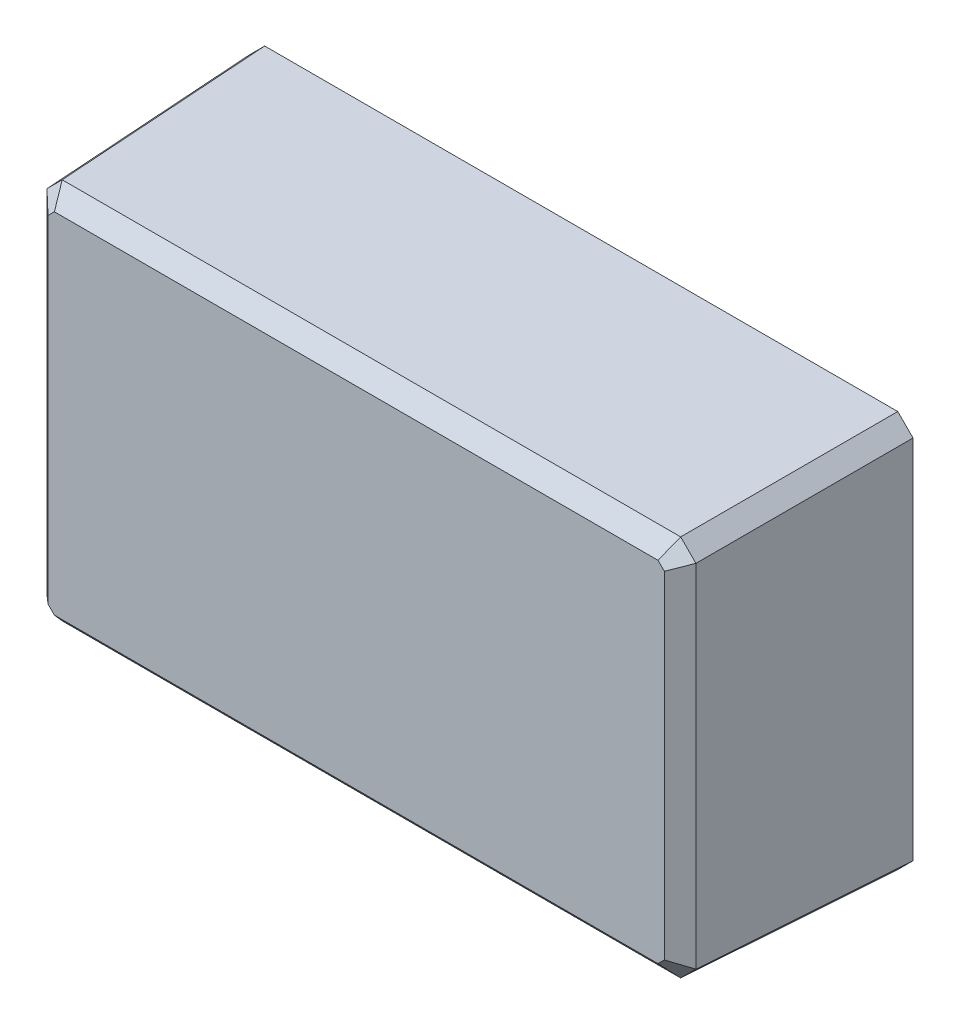
from build123d import *
from OCP.BRepFilletAPI import BRepFilletAPI_MakeChamfer

# Parameters (mm, degrees)
SKETCH1_W           = 87
SKETCH1_H           = 52
BOSS_EXTRUDE1_DEPTH = 29.5
BOSS_EXTRUDE1_TAPER = 2
CHAMFER1_SIZE       = 2
CHAMFER1_SIZE2      = 2.002440407
CHAMFER2_SIZE       = 2
CHAMFER2_SIZE2      = 2.073631911
CHAMFER2_SIZE2_2    = 2.106466142
SKETCH2_R           = 0.5
SKETCH2_R_2         = 1
BOSS_EXTRUDE2_DEPTH = 3.5


with BuildPart() as part:
    # Sketch1 → Boss-Extrude1 (new body)
    with BuildSketch(Plane.XY):
        Rectangle(SKETCH1_W, SKETCH1_H)
    extrude(amount=BOSS_EXTRUDE1_DEPTH, taper=BOSS_EXTRUDE1_TAPER)

    # Chamfer1: one chamfer whose edges measure the first distance from different faces: ONE call of the kernel's chamfer builder (chamfer() names one face for all edges)
    chamfer1_edges_1 = [part.edges().sort_by_distance(p)[0] for p in [
        (42.98491865, -25.48491865, 14.75),
    ]]
    chamfer1_side_1 = [part.faces().sort_by_distance(p)[0] for p in [
        (0, -25.486976029, 14.691084376),
    ]]
    chamfer1_edges_2 = [part.edges().sort_by_distance(p)[0] for p in [
        (-42.984918188, -25.484918188, 14.750013228),
    ]]
    chamfer1_side_2 = [part.faces().sort_by_distance(p)[0] for p in [
        (-42.988388791, 0, 14.650628158),
    ]]
    chamfer1_edges_3 = [part.edges().sort_by_distance(p)[0] for p in [
        (-42.98491865, 25.48491865, 14.75),
    ]]
    chamfer1_side_3 = [part.faces().sort_by_distance(p)[0] for p in [
        (0, 25.486976029, 14.691084376),
    ]]
    chamfer1_edges_4 = [part.edges().sort_by_distance(p)[0] for p in [
        (42.98491865, 25.48491865, 14.75),
    ]]
    chamfer1_side_4 = [part.faces().sort_by_distance(p)[0] for p in [
        (42.988388791, 0, 14.650628158),
    ]]
    chamfer1 = BRepFilletAPI_MakeChamfer(part.part.solid().wrapped)
    for e in chamfer1_edges_1:
        chamfer1.Add(CHAMFER1_SIZE, CHAMFER1_SIZE2, e.wrapped, chamfer1_side_1[0].wrapped)  # the first distance lies on this face
    for e in chamfer1_edges_2:
        chamfer1.Add(CHAMFER1_SIZE, CHAMFER1_SIZE2, e.wrapped, chamfer1_side_2[0].wrapped)  # the first distance lies on this face
    for e in chamfer1_edges_3:
        chamfer1.Add(CHAMFER1_SIZE, CHAMFER1_SIZE2, e.wrapped, chamfer1_side_3[0].wrapped)  # the first distance lies on this face
    for e in chamfer1_edges_4:
        chamfer1.Add(CHAMFER1_SIZE, CHAMFER1_SIZE2, e.wrapped, chamfer1_side_4[0].wrapped)  # the first distance lies on this face
    add(Compound.cast(chamfer1.Shape()), mode=Mode.REPLACE)

    # Chamfer2: one chamfer whose edges measure the first distance from different faces: ONE call of the kernel's chamfer builder (chamfer() names one face for all edges)
    chamfer2_edges_1 = [part.edges().sort_by_distance(p)[0] for p in [
        (42.4698373, 0.001220947, 29.5),
    ]]
    chamfer2_side_1 = [part.faces().sort_by_distance(p)[0] for p in [
        (42.988684703, 0.001220947, 14.642154351),
    ]]
    chamfer2_edges_2 = [part.edges().sort_by_distance(p)[0] for p in [
        (0.001220947, -24.9698373, 29.5),
    ]]
    chamfer2_side_2 = [part.faces().sort_by_distance(p)[0] for p in [
        (0.001220947, -25.487076554, 14.688205709),
    ]]
    chamfer2_edges_3 = [part.edges().sort_by_distance(p)[0] for p in [
        (-0.001220947, 24.9698373, 29.5),
    ]]
    chamfer2_side_3 = [part.faces().sort_by_distance(p)[0] for p in [
        (-0.001220947, 25.487076554, 14.688205709),
    ]]
    chamfer2_edges_4 = [part.edges().sort_by_distance(p)[0] for p in [
        (-42.4698373, -0.001220947, 29.5),
    ]]
    chamfer2_side_4 = [part.faces().sort_by_distance(p)[0] for p in [
        (-42.988684703, -0.001220947, 14.642154351),
    ]]
    chamfer2_edges_5 = [part.edges().sort_by_distance(p)[0] for p in [
        (-41.469228498, 23.968007551, 29.5),
    ]]
    chamfer2_side_5 = [part.faces().sort_by_distance(p)[0] for p in [
        (-41.984309848, 24.483088901, 14.75),
    ]]
    chamfer2_edges_6 = [part.edges().sort_by_distance(p)[0] for p in [
        (-41.468007551, -23.969228498, 29.5),
    ]]
    chamfer2_side_6 = [part.faces().sort_by_distance(p)[0] for p in [
        (-41.983088901, -24.484309848, 14.75),
    ]]
    chamfer2_edges_7 = [part.edges().sort_by_distance(p)[0] for p in [
        (41.468007551, 23.969228498, 29.5),
    ]]
    chamfer2_side_7 = [part.faces().sort_by_distance(p)[0] for p in [
        (41.983088901, 24.484309848, 14.75),
    ]]
    chamfer2_edges_8 = [part.edges().sort_by_distance(p)[0] for p in [
        (41.469228498, -23.968007551, 29.5),
    ]]
    chamfer2_side_8 = [part.faces().sort_by_distance(p)[0] for p in [
        (41.984309848, -24.483088901, 14.75),
    ]]
    chamfer2 = BRepFilletAPI_MakeChamfer(part.part.solid().wrapped)
    for e in chamfer2_edges_1:
        chamfer2.Add(CHAMFER2_SIZE, CHAMFER2_SIZE2, e.wrapped, chamfer2_side_1[0].wrapped)  # the first distance lies on this face
    for e in chamfer2_edges_2:
        chamfer2.Add(CHAMFER2_SIZE, CHAMFER2_SIZE2, e.wrapped, chamfer2_side_2[0].wrapped)  # the first distance lies on this face
    for e in chamfer2_edges_3:
        chamfer2.Add(CHAMFER2_SIZE, CHAMFER2_SIZE2, e.wrapped, chamfer2_side_3[0].wrapped)  # the first distance lies on this face
    for e in chamfer2_edges_4:
        chamfer2.Add(CHAMFER2_SIZE, CHAMFER2_SIZE2, e.wrapped, chamfer2_side_4[0].wrapped)  # the first distance lies on this face
    for e in chamfer2_edges_5:
        chamfer2.Add(CHAMFER2_SIZE, CHAMFER2_SIZE2_2, e.wrapped, chamfer2_side_5[0].wrapped)  # the first distance lies on this face
    for e in chamfer2_edges_6:
        chamfer2.Add(CHAMFER2_SIZE, CHAMFER2_SIZE2_2, e.wrapped, chamfer2_side_6[0].wrapped)  # the first distance lies on this face
    for e in chamfer2_edges_7:
        chamfer2.Add(CHAMFER2_SIZE, CHAMFER2_SIZE2_2, e.wrapped, chamfer2_side_7[0].wrapped)  # the first distance lies on this face
    for e in chamfer2_edges_8:
        chamfer2.Add(CHAMFER2_SIZE, CHAMFER2_SIZE2_2, e.wrapped, chamfer2_side_8[0].wrapped)  # the first distance lies on this face
    add(Compound.cast(chamfer2.Shape()), mode=Mode.REPLACE)

    # Sketch2 → Boss-Extrude2 (add)
    with BuildSketch(Plane(origin=(0, 0, 0), x_dir=(-1, 0, 0), z_dir=(0, 0, -1))):
        with Locations(Location((38.2, 21, 0), (0, 0, 180))):
            Circle(SKETCH2_R)
        with Locations(Location((38.2, 14.25, 0), (0, 0, 180))):
            Circle(SKETCH2_R)
        with Locations(Location((-37.8, -14.75, 0), (0, 0, 180))):
            Circle(SKETCH2_R_2)
        with Locations(Location((-37.8, -20.25, 0), (0, 0, 180))):
            Circle(SKETCH2_R_2)
    extrude(amount=BOSS_EXTRUDE2_DEPTH)


solid = part.part
